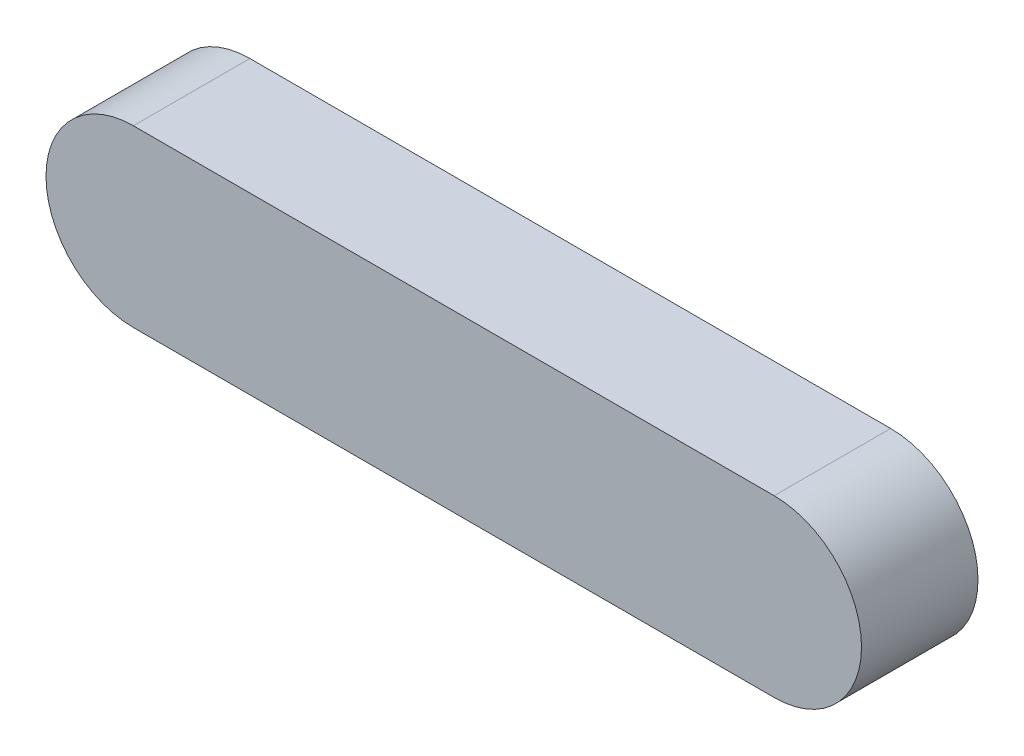
from build123d import *

# Parameters (mm, degrees)
EXTRUDE1_DEPTH = 8


with BuildPart() as part:
    # Sketch1 → Extrude1 (new body)
    with BuildSketch(Plane.XY):
        with BuildLine():
            Line((-22, 6), (22, 6))
            ThreePointArc((22, 6), (28, 0), (22, -6))
            Line((22, -6), (-22, -6))
            ThreePointArc((-22, -6), (-28, 0), (-22, 6))
        make_face()
    extrude(amount=EXTRUDE1_DEPTH)


solid = part.part
